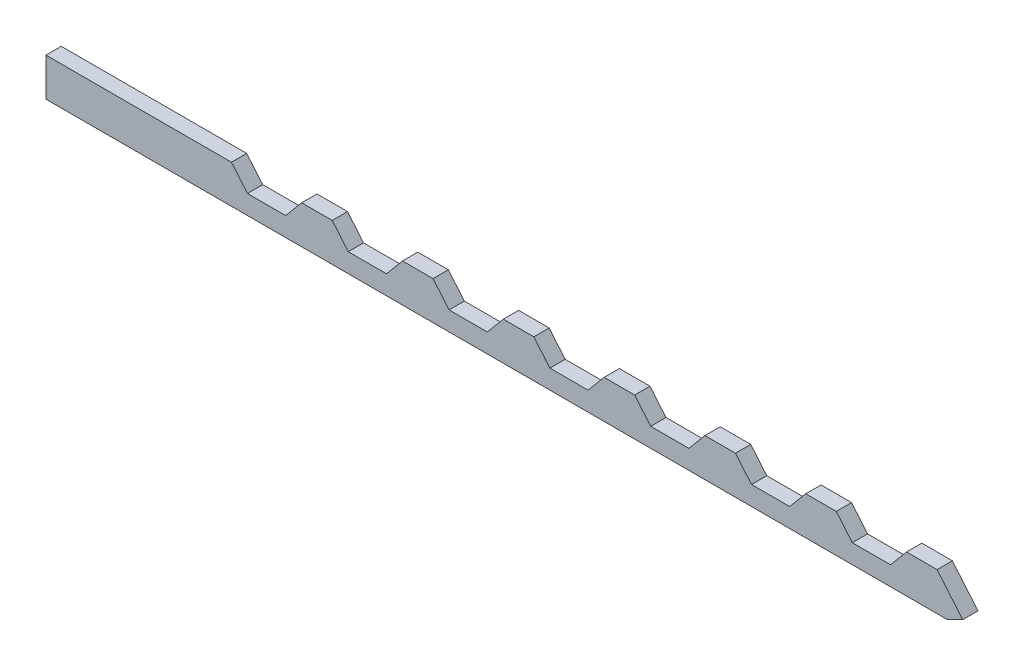
from build123d import *

# Parameters (mm, degrees)
SKETCH1_W           = 304.8
SKETCH1_H           = 12.7
BOSS_EXTRUDE1_DEPTH = 5.08
CUT_EXTRUDE1_DEPTH  = 153.616804121


with BuildPart() as part:
    # Sketch1 → Boss-Extrude1 (new body)
    with BuildSketch(Plane.XY):
        Rectangle(SKETCH1_W, SKETCH1_H)
    extrude(amount=BOSS_EXTRUDE1_DEPTH)

    # Sketch2 → Cut-Extrude1 (cut, through all)
    with BuildSketch(Plane.XY.offset(5.08)):
        Polygon((115.686465089, 0), (128.386465089, 0), (133.714747747, 6.35), (110.358182431, 6.35), align=None)
        Polygon((149.203030405, 0), (152.4, 0), (152.4, 6.35), (143.874747747, 6.35), align=None)
        Polygon((149.203030405, 0), (152.4, -3.81), (152.4, 0), align=None)
        Polygon((152.4, -3.81), (147.32, -6.35), (152.4, -6.35), align=None)
        Polygon((82.169899773, 0), (94.869899773, 0), (100.198182431, 6.35), (76.841617115, 6.35), align=None)
        Polygon((48.653334457, 0), (61.353334457, 0), (66.681617115, 6.35), (43.325051799, 6.35), align=None)
        Polygon((9.808486483, 6.35), (15.136769141, 0), (27.836769141, 0), (33.165051799, 6.35), align=None)
        Polygon((-23.708078833, 6.35), (-18.379796175, 0), (-5.679796175, 0), (-0.351513517, 6.35), align=None)
        Polygon((-57.224644148, 6.35), (-51.89636149, 0), (-39.19636149, 0), (-33.868078833, 6.35), align=None)
        Polygon((-90.741209464, 6.35), (-85.412926806, 0), (-72.712926806, 0), (-67.384644148, 6.35), align=None)
    extrude(amount=-CUT_EXTRUDE1_DEPTH, mode=Mode.SUBTRACT)


solid = part.part
